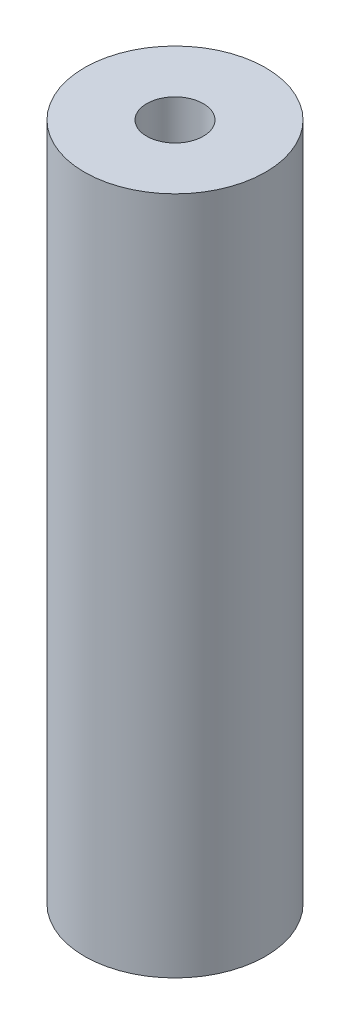
from build123d import *

# Parameters (mm, degrees)
SKETCH_1_R      = 4
EXTRUDE_1_DEPTH = 30
M3X0_51_D       = 2.5


with BuildPart() as part:
    # Эскиз1 → Бобышка-Вытянуть1 (new body)
    with BuildSketch(Plane(origin=(0, 0, 0), x_dir=(1, 0, 0), z_dir=(0, 1, 0))):
        with Locations(Location((0, 0, 0), (0, 0, 270))):
            Circle(SKETCH_1_R)
    extrude(amount=EXTRUDE_1_DEPTH)

    # Отверстие обработанное метчиком M3x0.51 (through all)
    with Locations(Plane(origin=(0, 0, 0), x_dir=(-1, 0, 0), z_dir=(0, -1, 0))):
        with Locations((0, 0)):
            Hole(M3X0_51_D / 2)


solid = part.part
